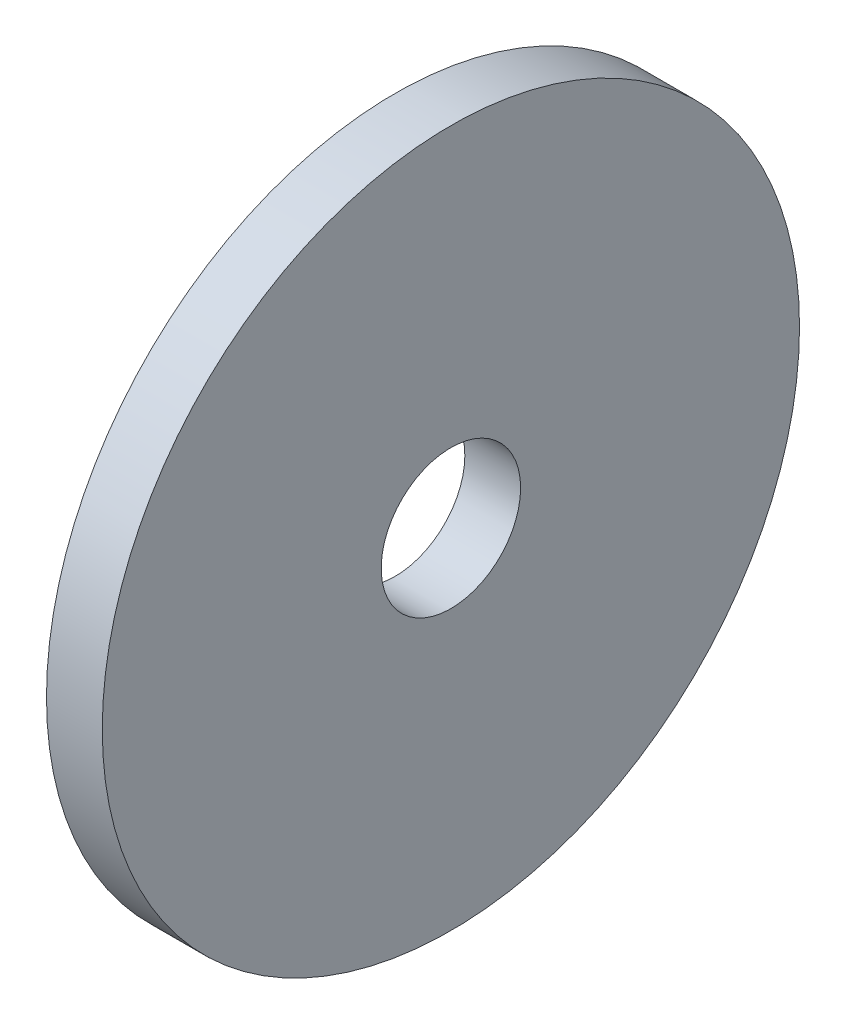
from build123d import *

# Parameters (mm, degrees)
SKETCH1_R           = 15.875
SKETCH1_R_2         = 3.175
BOSS_EXTRUDE1_DEPTH = 2.54


with BuildPart() as part:
    # Sketch1 → Boss-Extrude1 (new body)
    with BuildSketch(Plane.YZ):
        with Locations(Location((0, 0, 0), (0, 0, 270))):
            Circle(SKETCH1_R)
        with Locations(Location((0, 0, 0), (0, 0, 270))):
            Circle(SKETCH1_R_2, mode=Mode.SUBTRACT)
    extrude(amount=BOSS_EXTRUDE1_DEPTH)


solid = part.part
